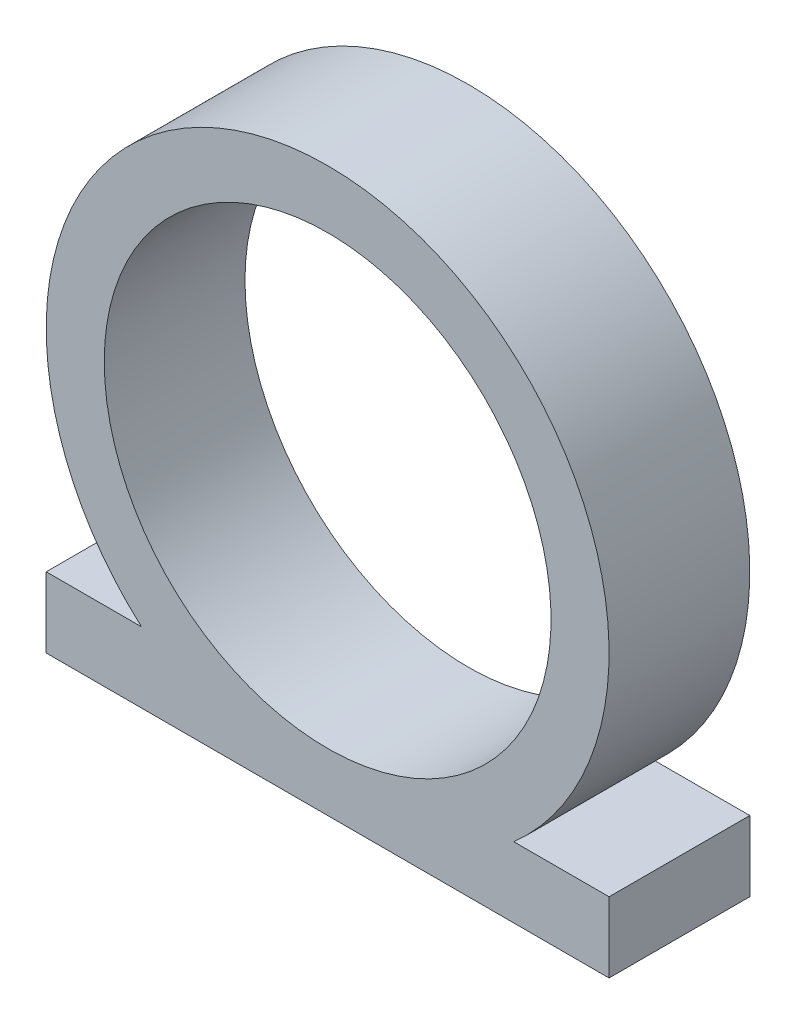
from build123d import *

# Parameters (mm, degrees)
SKETCH1_R           = 20
BOSS_EXTRUDE1_DEPTH = 10
SKETCH2_W           = 40
SKETCH2_H           = 5
BOSS_EXTRUDE2_DEPTH = 10
SKETCH3_R           = 15.875
CUT_EXTRUDE1_DEPTH  = 31


with BuildPart() as part:
    # Sketch1 → Boss-Extrude1 (new body)
    with BuildSketch(Plane.XY):
        Circle(SKETCH1_R)
    extrude(amount=BOSS_EXTRUDE1_DEPTH)

    # Sketch2 → Boss-Extrude2 (add)
    with BuildSketch(Plane(origin=(0, 0, 0), x_dir=(-1, 0, 0), z_dir=(0, 0, -1))):
        with Locations((0, -17.5)):
            Rectangle(SKETCH2_W, SKETCH2_H)
    extrude(amount=-BOSS_EXTRUDE2_DEPTH)

    # Sketch3 → Cut-Extrude1 (cut, through all)
    with BuildSketch(Plane(origin=(0, 0, 0), x_dir=(-1, 0, 0), z_dir=(0, 0, -1))):
        Circle(SKETCH3_R)
    extrude(amount=-CUT_EXTRUDE1_DEPTH, mode=Mode.SUBTRACT)


solid = part.part
